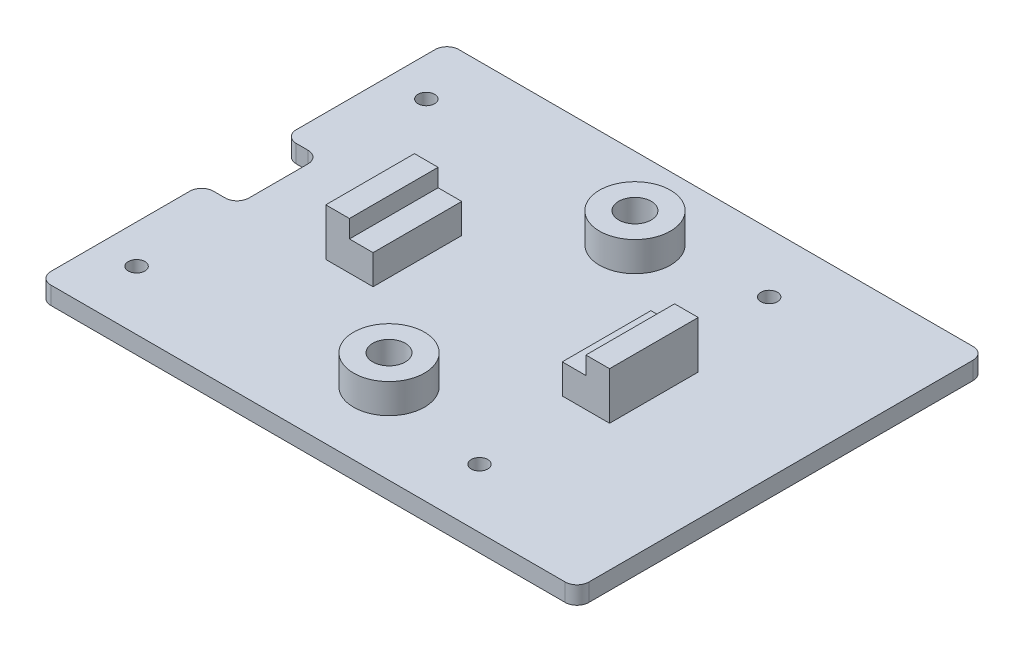
from build123d import *

# Parameters (mm, degrees)
SKETCH1_W           = 91
SKETCH1_H           = 69
BOSS_EXTRUDE1_DEPTH = 3
SKETCH2_W           = 6
SKETCH2_H           = 14
CUT_EXTRUDE1_DEPTH  = 58.179541796
SKETCH3_R           = 1.4
CUT_EXTRUDE2_DEPTH  = 58.179541796
FILLET1_R           = 2
SKETCH6_R           = 6
SKETCH6_W           = 8
SKETCH6_H           = 15
BOSS_EXTRUDE2_DEPTH = 5
SKETCH5_R           = 2.75
CUT_EXTRUDE3_DEPTH  = 58.658477261
SKETCH7_W           = 4
SKETCH7_H           = 15
BOSS_EXTRUDE3_DEPTH = 3


with BuildPart() as part:
    # Sketch1 → Boss-Extrude1 (new body)
    with BuildSketch(Plane(origin=(0, 0, 0), x_dir=(1, 0, 0), z_dir=(0, 1, 0))):
        Rectangle(SKETCH1_W, SKETCH1_H)
    extrude(amount=BOSS_EXTRUDE1_DEPTH)

    # Sketch2 → Cut-Extrude1 (cut, through all)
    with BuildSketch(Plane(origin=(0, 3, 0), x_dir=(1, 0, 0), z_dir=(0, 1, 0))):
        with Locations((-42.5, 0)):
            Rectangle(SKETCH2_W, SKETCH2_H)
    extrude(amount=-CUT_EXTRUDE1_DEPTH, mode=Mode.SUBTRACT)

    # Sketch3 → Cut-Extrude2 (cut, through all)
    with BuildSketch(Plane(origin=(0, 3, 0), x_dir=(1, 0, 0), z_dir=(0, 1, 0))):
        with Locations(Location((-39, 24.5, 0), (0, 0, 270))):
            Circle(SKETCH3_R)
        with Locations(Location((19, 24.5, 0), (0, 0, 270))):
            Circle(SKETCH3_R)
        with Locations(Location((19, -24.5, 0), (0, 0, 90))):
            Circle(SKETCH3_R)
        with Locations(Location((-39, -24.5, 0), (0, 0, 90))):
            Circle(SKETCH3_R)
    extrude(amount=-CUT_EXTRUDE2_DEPTH, mode=Mode.SUBTRACT)

    # Fillet1
    fillet1_edges = [part.edges().sort_by_distance(p)[0] for p in [
        (-45.5, 1.5, 7),
        (-45.5, 1.5, -7),
        (-39.5, 1.5, -7),
        (-39.5, 1.5, 7),
        (45.5, 1.5, 34.5),
        (-45.5, 1.5, 34.5),
        (-45.5, 1.5, -34.5),
        (45.5, 1.5, -34.5),
    ]]
    fillet(fillet1_edges, radius=FILLET1_R)

    # Sketch6 → Boss-Extrude2 (add)
    with BuildSketch(Plane(origin=(0, 3, 0), x_dir=(1, 0, 0), z_dir=(0, 1, 0))):
        with Locations(Location((0, -20.8, 0), (0, 0, 270))):
            Circle(SKETCH6_R)
        with Locations(Location((0, 20.8, 0), (0, 0, 270))):
            Circle(SKETCH6_R)
        with Locations((-20, 0)):
            Rectangle(SKETCH6_W, SKETCH6_H)
        with Locations((20, 0)):
            Rectangle(SKETCH6_W, SKETCH6_H)
    extrude(amount=BOSS_EXTRUDE2_DEPTH)

    # Sketch5 → Cut-Extrude3 (cut, through all)
    with BuildSketch(Plane(origin=(0, 0, 0), x_dir=(-1, 0, 0), z_dir=(0, -1, 0))):
        with Locations(Location((0, -20.8, 0), (0, 0, 90))):
            Circle(SKETCH5_R)
        with Locations(Location((0, 20.8, 0), (0, 0, 90))):
            Circle(SKETCH5_R)
    extrude(amount=-CUT_EXTRUDE3_DEPTH, mode=Mode.SUBTRACT)

    # Sketch7 → Boss-Extrude3 (add)
    with BuildSketch(Plane(origin=(0, 8, 0), x_dir=(1, 0, 0), z_dir=(0, 1, 0))):
        with Locations((22, 0)):
            Rectangle(SKETCH7_W, SKETCH7_H)
        with Locations((-22, 0)):
            Rectangle(SKETCH7_W, SKETCH7_H)
    extrude(amount=BOSS_EXTRUDE3_DEPTH)


solid = part.part
